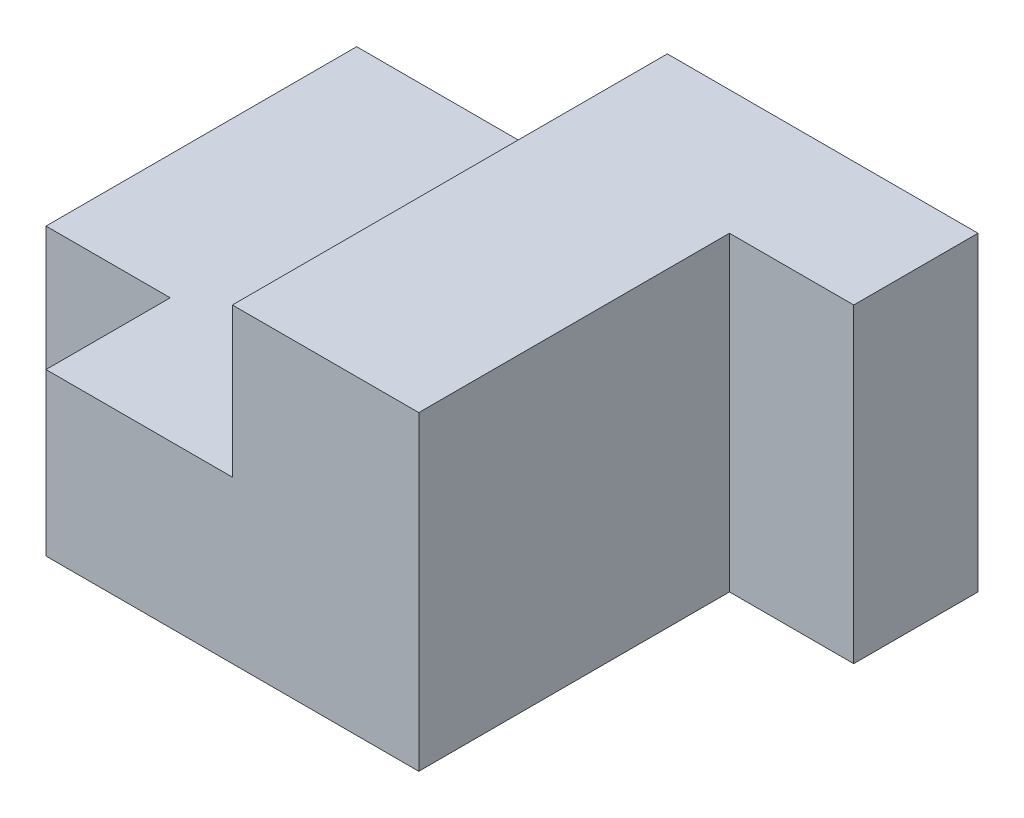
from build123d import *

# Parameters (mm, degrees)
BOSS_EXTRUDE1_DEPTH = 50
BOSS_EXTRUDE2_DEPTH = 26


with BuildPart() as part:
    # Sketch1 → Boss-Extrude1 (new body)
    with BuildSketch(Plane(origin=(0, 0, 0), x_dir=(1, 0, 0), z_dir=(0, 1, 0))):
        Polygon((27.425742574, 33.118811881), (27.425742574, 13.118811881), (7.425742574, 13.118811881), (7.425742574, -36.881188119), (-22.574257426, -36.881188119), (-22.574257426, 33.118811881), align=None)
    extrude(amount=BOSS_EXTRUDE1_DEPTH)

    # Sketch2 → Boss-Extrude2 (add)
    with BuildSketch(Plane(origin=(0, 0, 0), x_dir=(1, 0, 0), z_dir=(0, 1, 0))):
        Polygon((-22.574257426, 33.118811881), (-72.574257426, 33.118811881), (-72.574257426, -16.881188119), (-52.574257426, -16.881188119), (-52.574257426, -36.881188119), (-22.574257426, -36.881188119), align=None)
    extrude(amount=BOSS_EXTRUDE2_DEPTH)


solid = part.part
